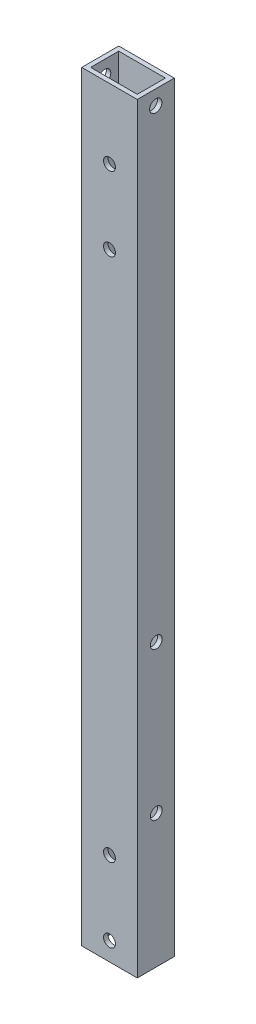
from build123d import *

# Parameters (mm, degrees)
SKETCH_1_W          = 15
SKETCH_1_H          = 10
SKETCH_1_W_2        = 12.6
SKETCH_1_H_2        = 7.6
EXTRUDE_1_DEPTH     = 110
SKETCH_2_R          = 1.6
CUT_EXTRUDE_1_DEPTH = 100
SKETCH_3_R          = 1.6
CUT_EXTRUDE_2_DEPTH = 15
SKETCH_5_W          = 15
SKETCH_5_H          = 10
CUT_EXTRUDE_4_DEPTH = 14.5
SKETCH_6_R          = 1.6
CUT_EXTRUDE_5_DEPTH = 15
CUT_EXTRUDE_6_DEPTH = 15


with BuildPart() as part:
    # ｽｹｯﾁ1 → ﾎﾞｽ - 押し出し1 (new, symmetric)
    with BuildSketch(Plane(origin=(0, 0, 0), x_dir=(1, 0, 0), z_dir=(0, 1, 0))):
        Rectangle(SKETCH_1_W, SKETCH_1_H)
        Rectangle(SKETCH_1_W_2, SKETCH_1_H_2, mode=Mode.SUBTRACT)
    extrude(amount=EXTRUDE_1_DEPTH, both=True)

    # ｽｹｯﾁ2 → ｶｯﾄ - 押し出し1 (cut)
    with BuildSketch(Plane(origin=(0, 0, -5), x_dir=(-1, 0, 0), z_dir=(0, 0, -1))):
        with Locations((0, -85)):
            Circle(SKETCH_2_R)
        with Locations((0, -105)):
            Circle(SKETCH_2_R)
    extrude(amount=-CUT_EXTRUDE_1_DEPTH, mode=Mode.SUBTRACT)

    # ｽｹｯﾁ3 → ｶｯﾄ - 押し出し2 (cut)
    with BuildSketch(Plane.ZY.offset(7.5)):
        with Locations((-0.125, -74)):
            Circle(SKETCH_3_R)
        with Locations((-0.125, -34)):
            Circle(SKETCH_3_R)
    extrude(amount=-CUT_EXTRUDE_2_DEPTH, mode=Mode.SUBTRACT)

    # ｽｹｯﾁ5 → ｶｯﾄ - 押し出し4 (cut)
    with BuildSketch(Plane(origin=(0, 110, 0), x_dir=(1, 0, 0), z_dir=(0, 1, 0))):
        Rectangle(SKETCH_5_W, SKETCH_5_H)
    extrude(amount=-CUT_EXTRUDE_4_DEPTH, mode=Mode.SUBTRACT)

    # ｽｹｯﾁ6 → ｶｯﾄ - 押し出し5 (cut)
    with BuildSketch(Plane(origin=(0, 0, -5), x_dir=(-1, 0, 0), z_dir=(0, 0, -1))):
        with Locations((0, 56.66)):
            Circle(SKETCH_6_R)
        with Locations((0, 76.66)):
            Circle(SKETCH_6_R)
    extrude(amount=-CUT_EXTRUDE_5_DEPTH, mode=Mode.SUBTRACT)

    # ｽｹｯﾁ7 → ｶｯﾄ - 押し出し6 (cut)
    with BuildSketch(Plane.ZY.offset(7.5)):
        with BuildLine():
            ThreePointArc((0, 93.15), (-1.65, 91.5), (0, 89.85))
            ThreePointArc((0, 89.85), (1.65, 91.5), (0, 93.15))
        make_face()
    extrude(amount=-CUT_EXTRUDE_6_DEPTH, mode=Mode.SUBTRACT)


solid = part.part
